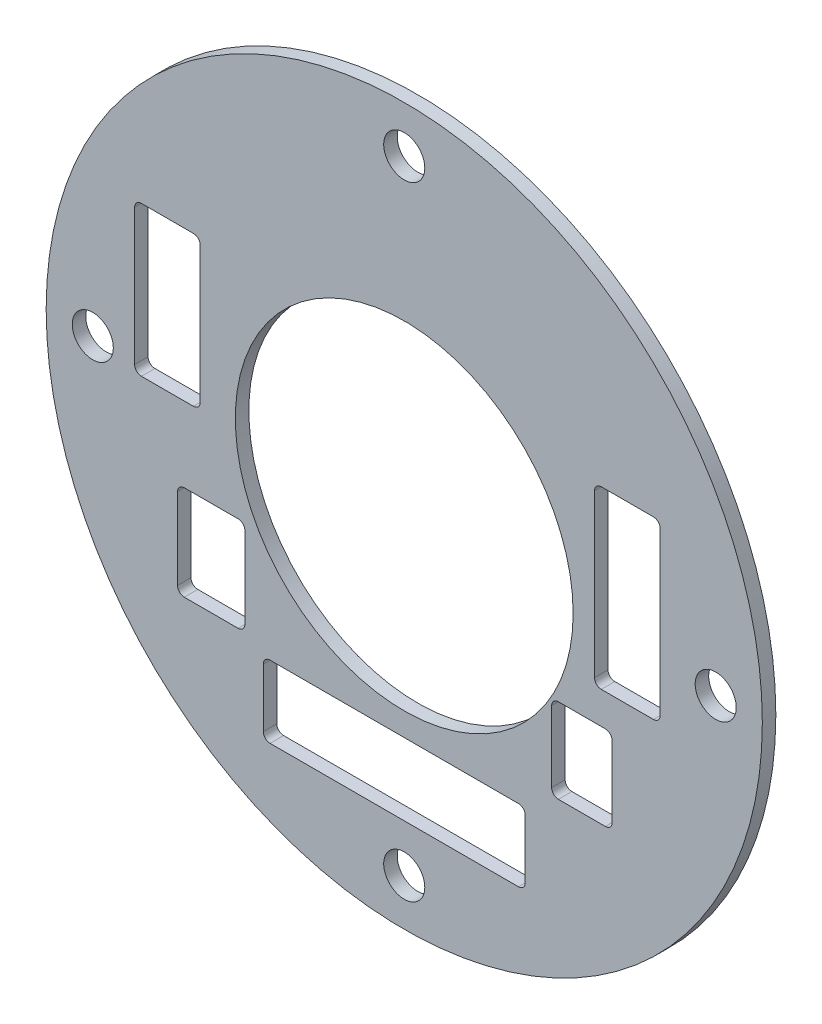
from build123d import *

# Parameters (mm, degrees)
SKETCH_1_R          = 26.5
SKETCH_1_R_2        = 12.5
EXTRUDE_1_DEPTH     = 1
CUT_EXTRUDE_START   = 2.5
CUT_EXTRUDE_1_DEPTH = 1
SKETCH_3_R          = 1.52
CUT_EXTRUDE_2_DEPTH = 1


with BuildPart() as part:
    # 草图1 → 凸台-拉伸1 (new body)
    with BuildSketch(Plane.XY):
        Circle(SKETCH_1_R)
        Circle(SKETCH_1_R_2, mode=Mode.SUBTRACT)
    extrude(amount=EXTRUDE_1_DEPTH)

    # 草图2 → 切除-拉伸1 (cut)
    with BuildSketch(Plane(origin=(22.803986485, -9.350307143, -2.5), x_dir=(1, 0, 0), z_dir=(0, 0, 1)).offset(CUT_EXTRUDE_START)):
        with BuildLine():
            Line((-38.401990025, 19.652309401), (-42.257990025, 19.652309401))
            ThreePointArc((-42.257990025, 19.652309401), (-42.611543416, 19.505862792), (-42.757990025, 19.152309401))
            Line((-42.757990025, 19.152309401), (-42.757990025, 9.073309401))
            ThreePointArc((-42.757990025, 9.073309401), (-42.611543416, 8.719756011), (-42.257990025, 8.573309401))
            Line((-42.257990025, 8.573309401), (-38.401990025, 8.573309401))
            ThreePointArc((-38.401990025, 8.573309401), (-38.048436635, 8.719756011), (-37.901990025, 9.073309401))
            Line((-37.901990025, 9.073309401), (-37.901990025, 19.152309401))
            ThreePointArc((-37.901990025, 19.152309401), (-38.048436635, 19.505862792), (-38.401990025, 19.652309401))
        make_face()
        with BuildLine():
            Line((-8.221986913, 18.50930464), (-4.365986913, 18.50930464))
            ThreePointArc((-4.365986913, 18.50930464), (-4.012433522, 18.362858031), (-3.865986913, 18.00930464))
            Line((-3.865986913, 18.00930464), (-3.865986913, 6.02530464))
            ThreePointArc((-3.865986913, 6.02530464), (-4.012433522, 5.67175125), (-4.365986913, 5.52530464))
            Line((-4.365986913, 5.52530464), (-8.221986913, 5.52530464))
            ThreePointArc((-8.221986913, 5.52530464), (-8.575540303, 5.67175125), (-8.721986913, 6.02530464))
            Line((-8.721986913, 6.02530464), (-8.721986913, 18.00930464))
            ThreePointArc((-8.721986913, 18.00930464), (-8.575540303, 18.362858031), (-8.221986913, 18.50930464))
        make_face()
        with BuildLine():
            Line((-32.732983006, -4.858695665), (-14.351988011, -4.858695665))
            ThreePointArc((-14.351988011, -4.858695665), (-13.998434621, -5.005142274), (-13.851988011, -5.358695665))
            Line((-13.851988011, -5.358695665), (-13.851988011, -9.690695176))
            ThreePointArc((-13.851988011, -9.690695176), (-13.998434621, -10.044248567), (-14.351988011, -10.190695176))
            Line((-14.351988011, -10.190695176), (-32.732983006, -10.190695176))
            ThreePointArc((-32.732983006, -10.190695176), (-33.086536397, -10.044248567), (-33.232983006, -9.690695176))
            Line((-33.232983006, -9.690695176), (-33.232983006, -5.358695665))
            ThreePointArc((-33.232983006, -5.358695665), (-33.086536397, -5.005142274), (-32.732983006, -4.858695665))
        make_face()
        with BuildLine():
            Line((-35.099987523, 3.015306044), (-39.082987523, 3.015306044))
            ThreePointArc((-39.082987523, 3.015306044), (-39.436540913, 2.868859435), (-39.582987523, 2.515306044))
            Line((-39.582987523, 2.515306044), (-39.582987523, -3.499693956))
            ThreePointArc((-39.582987523, -3.499693956), (-39.436540913, -3.853247346), (-39.082987523, -3.999693956))
            Line((-39.082987523, -3.999693956), (-35.099987523, -3.999693956))
            ThreePointArc((-35.099987523, -3.999693956), (-34.746434132, -3.853247346), (-34.599987523, -3.499693956))
            Line((-34.599987523, -3.499693956), (-34.599987523, 2.515306044))
            ThreePointArc((-34.599987523, 2.515306044), (-34.746434132, 2.868859435), (-35.099987523, 3.015306044))
        make_face()
        with BuildLine():
            Line((-11.396988316, 3.142309279), (-7.921988316, 3.142309279))
            ThreePointArc((-7.921988316, 3.142309279), (-7.568434926, 2.99586267), (-7.421988316, 2.642309279))
            Line((-7.421988316, 2.642309279), (-7.421988316, -2.610690721))
            ThreePointArc((-7.421988316, -2.610690721), (-7.568434926, -2.964244111), (-7.921988316, -3.110690721))
            Line((-7.921988316, -3.110690721), (-11.396988316, -3.110690721))
            ThreePointArc((-11.396988316, -3.110690721), (-11.750541707, -2.964244111), (-11.896988316, -2.610690721))
            Line((-11.896988316, -2.610690721), (-11.896988316, 2.642309279))
            ThreePointArc((-11.896988316, 2.642309279), (-11.750541707, 2.99586267), (-11.396988316, 3.142309279))
        make_face()
    extrude(amount=CUT_EXTRUDE_1_DEPTH, mode=Mode.SUBTRACT)

    # 草图3 → 切除-拉伸2 (cut)
    with BuildSketch(Plane(origin=(22.803986485, -9.350307143, -2.5), x_dir=(1, 0, 0), z_dir=(0, 0, 1)).offset(CUT_EXTRUDE_START)):
        with Locations((-22.803986485, 32.400306763)):
            Circle(SKETCH_3_R)
        with Locations((-45.853986105, 9.350307143)):
            Circle(SKETCH_3_R)
        with Locations((-22.803986485, -13.699692477)):
            Circle(SKETCH_3_R)
        with Locations((0.246013135, 9.350307143)):
            Circle(SKETCH_3_R)
    extrude(amount=CUT_EXTRUDE_2_DEPTH, mode=Mode.SUBTRACT)


solid = part.part
